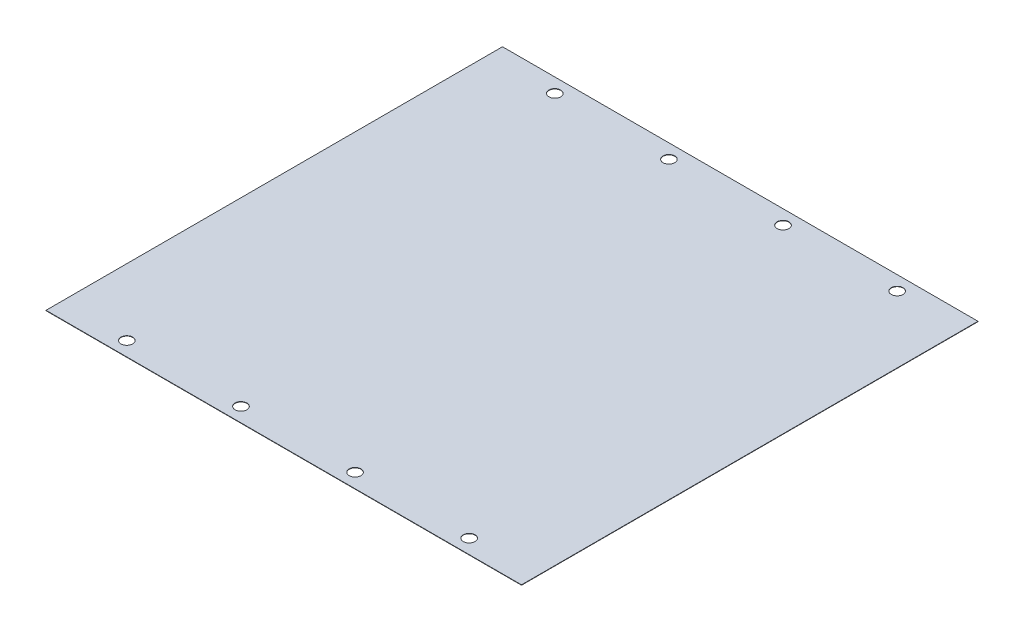
from build123d import *

# Parameters (mm, degrees)
SKETCH_1_W        = 250
SKETCH_1_H        = 240
SKETCH_1_R        = 3.1
EXTRUDE_421_DEPTH = 0.2


with BuildPart() as part:
    # Эскиз1 → Extrude 421 (new body)
    with BuildSketch(Plane(origin=(0, 0, 0), x_dir=(1, 0, 0), z_dir=(0, 1, 0))):
        Rectangle(SKETCH_1_W, SKETCH_1_H)
        with Locations(Location((-90, 112.5, 0), (0, 0, 270))):
            Circle(SKETCH_1_R, mode=Mode.SUBTRACT)
        with Locations(Location((-30, 112.5, 0), (0, 0, 270))):
            Circle(SKETCH_1_R, mode=Mode.SUBTRACT)
        with Locations(Location((30, 112.5, 0), (0, 0, 270))):
            Circle(SKETCH_1_R, mode=Mode.SUBTRACT)
        with Locations(Location((90, 112.5, 0), (0, 0, 270))):
            Circle(SKETCH_1_R, mode=Mode.SUBTRACT)
        with Locations(Location((90, -112.5, 0), (0, 0, 270))):
            Circle(SKETCH_1_R, mode=Mode.SUBTRACT)
        with Locations(Location((30, -112.5, 0), (0, 0, 270))):
            Circle(SKETCH_1_R, mode=Mode.SUBTRACT)
        with Locations(Location((-30, -112.5, 0), (0, 0, 270))):
            Circle(SKETCH_1_R, mode=Mode.SUBTRACT)
        with Locations(Location((-90, -112.5, 0), (0, 0, 270))):
            Circle(SKETCH_1_R, mode=Mode.SUBTRACT)
    extrude(amount=EXTRUDE_421_DEPTH)


solid = part.part
